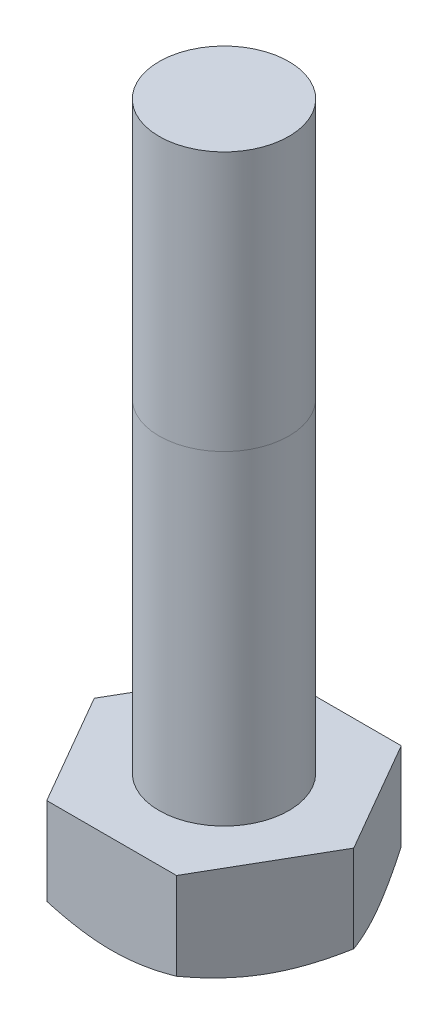
from build123d import *

# Parameters (mm, degrees)
BOSS_EXTRUDE1_DEPTH = 15
SKETCH2_R           = 10
BOSS_EXTRUDE2_DEPTH = 90
SKETCH3_OUTSIDE_W   = 377.286
SKETCH3_OUTSIDE_H   = 371.928
SKETCH3_OUTSIDE_R   = 17.320508076
CUT_EXTRUDE1_DEPTH  = 90
CUT_EXTRUDE1_DRAFT  = -60


with BuildPart() as part:
    # Sketch1 → Boss-Extrude1 (new body)
    with BuildSketch(Plane(origin=(0, 0, 0), x_dir=(1, 0, 0), z_dir=(0, 1, 0))):
        Polygon((20, 0), (10, 17.320508076), (-10, 17.320508076), (-20, 0), (-10, -17.320508076), (10, -17.320508076), align=None)
    extrude(amount=BOSS_EXTRUDE1_DEPTH)

    # Sketch2 → Boss-Extrude2 (add)
    with BuildSketch(Plane(origin=(0, 15, 0), x_dir=(1, 0, 0), z_dir=(0, 1, 0))):
        with Locations(Location((0, 0, 0), (0, 0, 90))):
            Circle(SKETCH2_R)
    extrude(amount=BOSS_EXTRUDE2_DEPTH)


with BuildPart() as cut_extrude1_tool:
    # Sketch3 outside → Cut-Extrude1 (with draft: the straight prism first)
    with BuildSketch(Plane.XZ):
        Rectangle(SKETCH3_OUTSIDE_W, SKETCH3_OUTSIDE_H)
        Circle(SKETCH3_OUTSIDE_R, mode=Mode.SUBTRACT)
    extrude(amount=-CUT_EXTRUDE1_DEPTH)
    # Cut-Extrude1: the draft: its side faces are tilted about the plane it starts from
    cut_extrude1_sides = [cut_extrude1_tool.faces().sort_by_distance(p)[0] for p in [
        (0, 45, -185.964),
        (188.643, 45, 0),
        (0, 45, 185.964),
        (-188.643, 45, 0),
        (-17.320508076, 45, 0),
    ]]
    draft(cut_extrude1_sides, Plane.XZ, CUT_EXTRUDE1_DRAFT)


with BuildPart() as part_1:
    add(part.part)

    # Cut-Extrude1: cut by cut_extrude1_tool
    add(cut_extrude1_tool.part, mode=Mode.SUBTRACT)


solid = part_1.part
